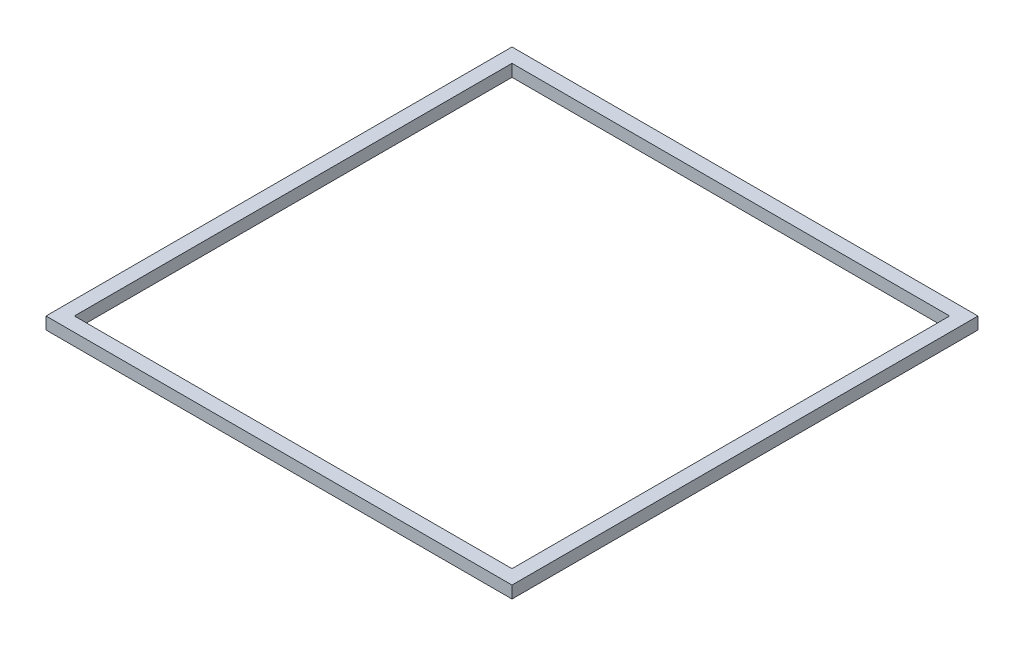
from build123d import *

# Parameters (mm, degrees)
SKETCH_2_W      = 115
SKETCH_2_H      = 115
SKETCH_2_W_2    = 108
SKETCH_2_H_2    = 108
EXTRUDE_2_DEPTH = 3


with BuildPart() as part:
    # 스케치2 → 보스-돌출2 (new body)
    with BuildSketch(Plane(origin=(0, 0, 0), x_dir=(1, 0, 0), z_dir=(0, 1, 0))):
        Rectangle(SKETCH_2_W, SKETCH_2_H)
        Rectangle(SKETCH_2_W_2, SKETCH_2_H_2, mode=Mode.SUBTRACT)
    extrude(amount=EXTRUDE_2_DEPTH)


solid = part.part
